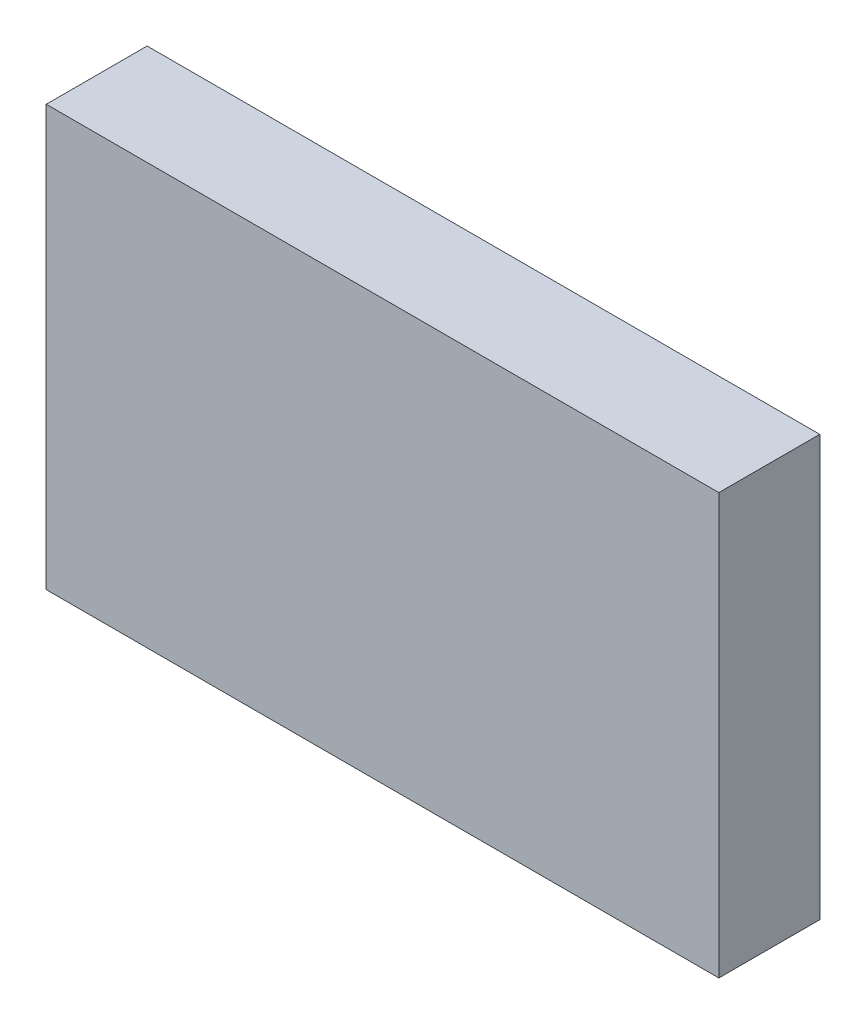
from build123d import *

# Parameters (mm, degrees)
SKETCH_1_W      = 80
SKETCH_1_H      = 50
EXTRUDE_1_DEPTH = 12


with BuildPart() as part:
    # 草图1 → 凸台-拉伸1 (new body)
    with BuildSketch(Plane.XY):
        with Locations((40, 25)):
            Rectangle(SKETCH_1_W, SKETCH_1_H)
    extrude(amount=EXTRUDE_1_DEPTH)


solid = part.part
